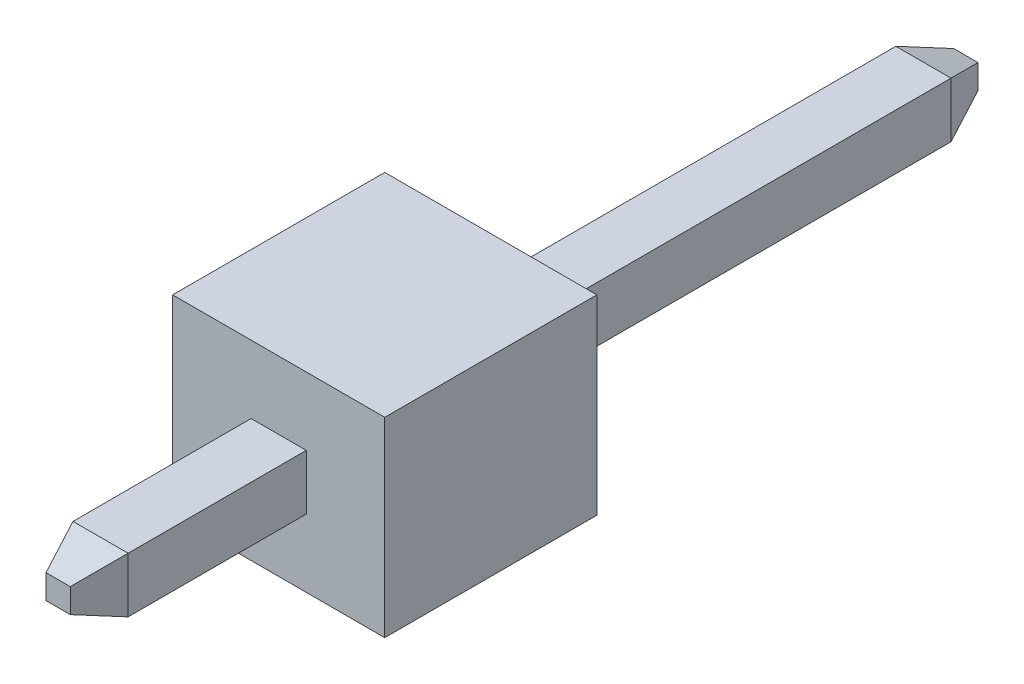
from build123d import *

# Parameters (mm, degrees)
SKETCH1_W                = 2.5
SKETCH1_H                = 2.25
BOSS_EXTRUDE1_DEPTH      = 1.25
BOSS_EXTRUDE2_DEPTH      = 3.35
BOSS_EXTRUDE2_DEPTH_BACK = 6.35
SKETCH2_W                = 0.65
SKETCH2_H                = 0.65
SKETCH3_W                = 0.65
SKETCH3_H                = 0.65
BOSS_EXTRUDE3_DEPTH      = 0.5
BOSS_EXTRUDE3_TAPER      = 20
SKETCH7_W                = 0.65
SKETCH7_H                = 0.65
BOSS_EXTRUDE6_DEPTH      = 0.5
BOSS_EXTRUDE6_TAPER      = 20


with BuildPart() as part:
    # Sketch1 → Boss-Extrude1 (new, symmetric)
    with BuildSketch(Plane.XY):
        Rectangle(SKETCH1_W, SKETCH1_H)
    extrude(amount=BOSS_EXTRUDE1_DEPTH, both=True)

    # Sketch2 → Boss-Extrude2 (add, two sides: drawn at the far end of the back side and taken through both)
    with BuildSketch(Plane.XY.offset(-BOSS_EXTRUDE2_DEPTH_BACK)):
        Rectangle(SKETCH2_W, SKETCH2_H)
    extrude(amount=BOSS_EXTRUDE2_DEPTH + BOSS_EXTRUDE2_DEPTH_BACK)

    # Sketch3 → Boss-Extrude3 (add)
    with BuildSketch(Plane(origin=(0, 0, -6.35), x_dir=(-1, 0, 0), z_dir=(0, 0, -1))):
        Rectangle(SKETCH3_W, SKETCH3_H)
    extrude(amount=BOSS_EXTRUDE3_DEPTH, taper=BOSS_EXTRUDE3_TAPER)

    # Sketch7 → Boss-Extrude6 (add)
    with BuildSketch(Plane.XY.offset(3.35)):
        Rectangle(SKETCH7_W, SKETCH7_H)
    extrude(amount=BOSS_EXTRUDE6_DEPTH, taper=BOSS_EXTRUDE6_TAPER)


solid = part.part
